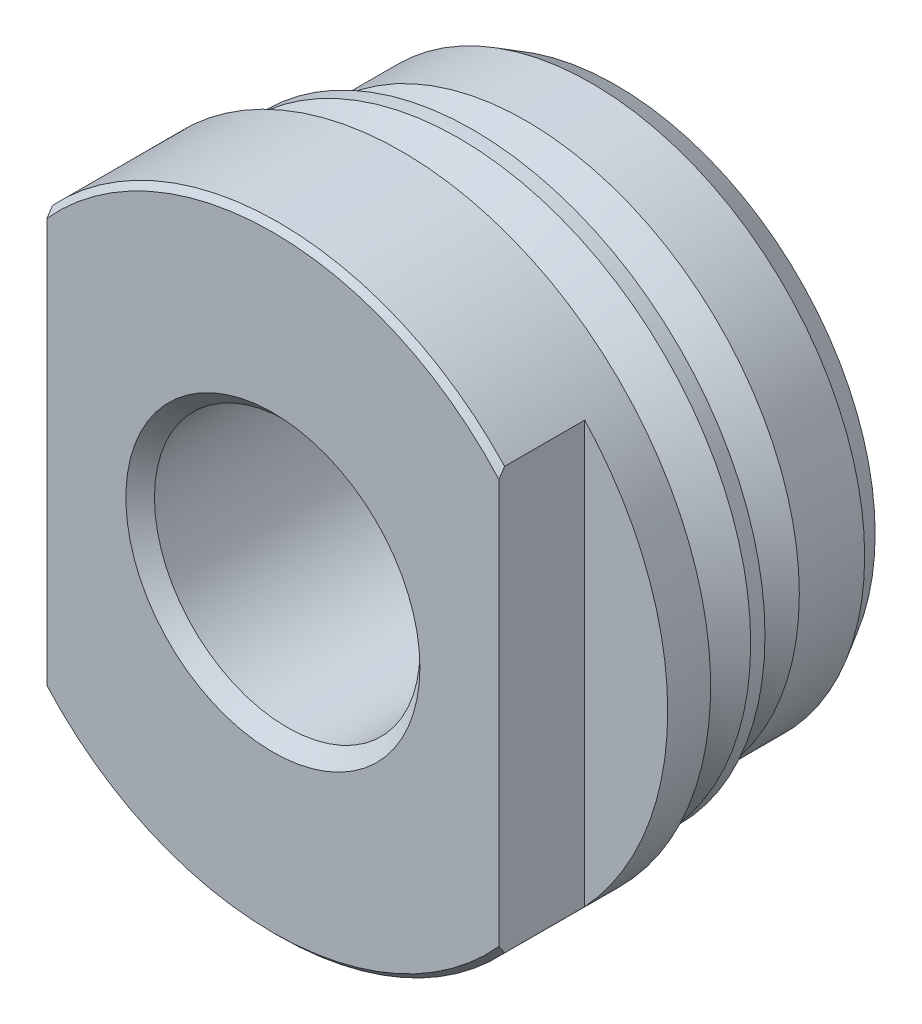
from build123d import *

# Parameters (mm, degrees)
SKETCH1_R                = 9.55
TUBEINTERFACE1_DEPTH     = 5
SKETCH3_R                = 10.8
BODY_DEPTH               = 7
BODYCHAMFER_SIZE         = 0.2
SKETCH4_W                = 10
SKETCH4_H                = 75
FLATS_DEPTH              = 3
SKETCH27_R               = 7
HEADCOVERBORE_DEPTH      = 3
SKETCH28_R               = 4.639
INLINE_PORT_DEPTH        = 20.423696867
INLINE_PORT_CHAMFER_SIZE = 0.5
CHAMFER4_SIZE            = 0.5
CHAMFER4_SIZE2           = 0.866025404


with BuildPart() as part:
    # Sketch1 → TubeInterface1 (new body)
    with BuildSketch(Plane.XY):
        Circle(SKETCH1_R)
    extrude(amount=TUBEINTERFACE1_DEPTH)

    # Sketch3 → Body (add)
    with BuildSketch(Plane.XY.offset(5)):
        Circle(SKETCH3_R)
    extrude(amount=BODY_DEPTH)

    # BodyChamfer
    bodychamfer_edges = [part.edges().sort_by_distance(p)[0] for p in [
        (-10.8, 0, 12),
    ]]
    chamfer(bodychamfer_edges, length=BODYCHAMFER_SIZE)

    # Sketch4 → Flats (cut)
    with BuildSketch(Plane.XY.offset(12)):
        with Locations((-12.9, 0)):
            Rectangle(SKETCH4_W, SKETCH4_H)
        with Locations((12.9, 0)):
            Rectangle(SKETCH4_W, SKETCH4_H)
    extrude(amount=-FLATS_DEPTH, mode=Mode.SUBTRACT)

    # Sketch23 → RodCoverCrimp (revolve, cut)
    with BuildSketch(Plane(origin=(0, 0, 0), x_dir=(0, 0, -1), z_dir=(1, 0, 0)), mode=Mode.PRIVATE) as rodcovercrimp_sk:
        Polygon((-7.5, 13.6), (-5, 13.6), (-5, 10.2), (-5.5, 10.2), (-7.1, 8.6), (-7.5, 8.6), align=None)
    revolve(rodcovercrimp_sk.sketch.rotate(Axis((0, 0, 0), (0, 0, -1)), 90), axis=Axis((0, 0, 0), (0, 0, -1)), mode=Mode.SUBTRACT)

    # Sketch24 → TubeInterfaceCrimp (revolve, cut)
    with BuildSketch(Plane(origin=(0, 0, 0), x_dir=(0, 0, -1), z_dir=(1, 0, 0)), mode=Mode.PRIVATE) as tubeinterfacecrimp_sk:
        Polygon((-5, 34.292463075), (-5, 8.6), (-4.1, 8.6), (-3.15, 9.55), (0, 9.55), (0, 34.292463075), align=None)
    revolve(tubeinterfacecrimp_sk.sketch.rotate(Axis((0, 0, 0), (0, 0, -1)), 90), axis=Axis((0, 0, 0), (0, 0, -1)), mode=Mode.SUBTRACT)

    # Sketch27 → HeadCoverBore (cut)
    with BuildSketch(Plane(origin=(0, 0, 0), x_dir=(-1, 0, 0), z_dir=(0, 0, -1))):
        Circle(SKETCH27_R)
    extrude(amount=-HEADCOVERBORE_DEPTH, mode=Mode.SUBTRACT)

    # Sketch28 → Inline Port (cut, through all)
    with BuildSketch(Plane.XY.offset(12)):
        Circle(SKETCH28_R)
    extrude(amount=-INLINE_PORT_DEPTH, mode=Mode.SUBTRACT)

    # Inline Port Chamfer
    inline_port_chamfer_edges = [part.edges().sort_by_distance(p)[0] for p in [
        (-4.639, 0, 12),
    ]]
    chamfer(inline_port_chamfer_edges, length=INLINE_PORT_CHAMFER_SIZE)

    # Chamfer4
    chamfer4_edges = [part.edges().sort_by_distance(p)[0] for p in [
        (-9.55, 0, 0),
    ]]
    chamfer4_side = [part.faces().sort_by_distance(p)[0] for p in [
        (-9.27988521, 0, 0),
    ]]
    chamfer(chamfer4_edges, length=CHAMFER4_SIZE, length2=CHAMFER4_SIZE2, reference=chamfer4_side[0])


solid = part.part
